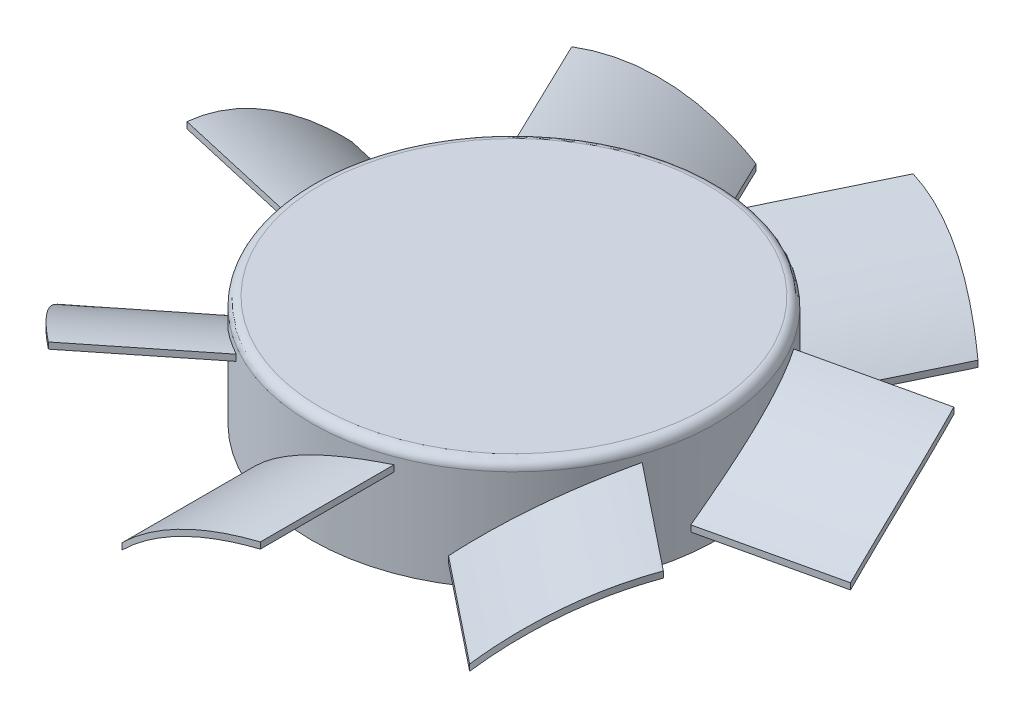
from build123d import *

# Parameters (mm, degrees)
SKETCH_1_R               = 11
EXTRUDE_1_DEPTH          = 6
EXTRUDE_2_DEPTH          = 25
PATTERN_CIRCULAR_1_COUNT = 7
SKETCH_4_R               = 35
SKETCH_4_R_2             = 18
CUT_EXTRUDE_2_DEPTH      = 25
FILLET_1_R               = 0.5
SKETCH_2_R               = 4.1
CUT_EXTRUDE_1_DEPTH      = 5


with BuildPart() as part:
    # Эскиз1 → Бобышка-Вытянуть1 (new body)
    with BuildSketch(Plane(origin=(0, 0, 0), x_dir=(1, 0, 0), z_dir=(0, 1, 0))):
        with Locations(Location((0, 0, 0), (0, 0, 270))):
            Circle(SKETCH_1_R)
    extrude(amount=EXTRUDE_1_DEPTH)

    # Эскиз3 → Бобышка-Вытянуть2 (add)
    with BuildSketch(Plane.XY):
        with BuildLine():
            Line((-3.7, 1.34), (-3.7, 1))
            add(Edge.make_bspline(
                [(3.8, 4.78), (0.931582196, 4.533244366), (-1.689682262, 2.992121942), (-3.7, 1)],
                knots=[0, 0, 0, 0, 1, 1, 1, 1], degree=3))
            Line((3.8, 4.78), (3.8, 5.12))
            add(Edge.make_bspline(
                [(3.8, 5.12), (0.931582196, 4.873244366), (-1.689682262, 3.332121942), (-3.7, 1.34)],
                knots=[0, 0, 0, 0, 1, 1, 1, 1], degree=3))
        make_face()
    extrude_2 = extrude(amount=EXTRUDE_2_DEPTH)

    # Круговой массив1: Бобышка-Вытянуть2 ×7 about axis
    pattern_circular_1_axis = Axis((0, 6, 0), (0, 1, 0))
    for i in range(1, PATTERN_CIRCULAR_1_COUNT):
        add(extrude_2.rotate(pattern_circular_1_axis, i * 360 / PATTERN_CIRCULAR_1_COUNT))

    # Эскиз4 → Вырез-Вытянуть2 (cut)
    with BuildSketch(Plane(origin=(0, 6, 0), x_dir=(1, 0, 0), z_dir=(0, 1, 0))):
        Circle(SKETCH_4_R)
        Circle(SKETCH_4_R_2, mode=Mode.SUBTRACT)
    extrude(amount=-CUT_EXTRUDE_2_DEPTH, mode=Mode.SUBTRACT)

    # Скругление1
    fillet_1_edges = [part.edges().sort_by_distance(p)[0] for p in [
        (0, 6, -11),
    ]]
    fillet(fillet_1_edges, radius=FILLET_1_R)

    # Эскиз2 → Вырез-Вытянуть1 (cut)
    with BuildSketch(Plane.XZ):
        with Locations(Location((0, 0, 0), (0, 0, 270))):
            Circle(SKETCH_2_R)
    extrude(amount=-CUT_EXTRUDE_1_DEPTH, mode=Mode.SUBTRACT)


solid = part.part
